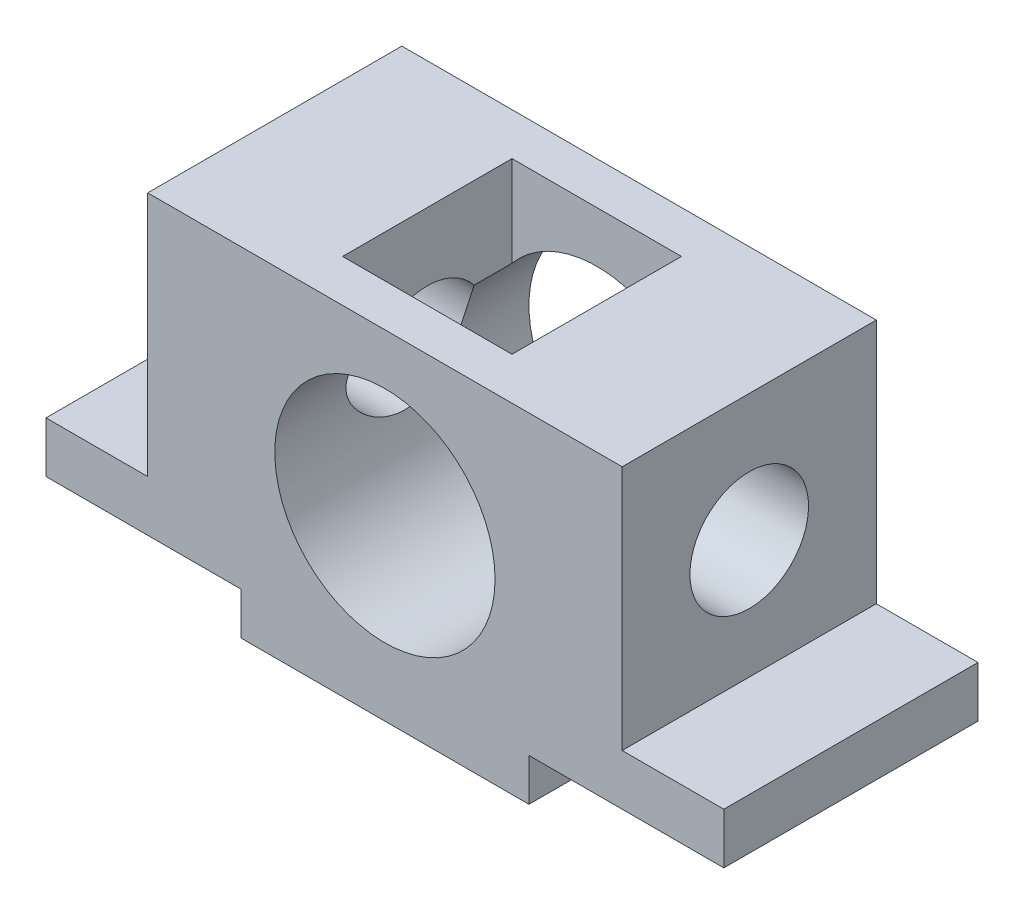
from build123d import *

# Parameters (mm, degrees)
EXTRUDE_1_DEPTH     = 30
SKETCH_2_R          = 13
CUT_EXTRUDE_1_DEPTH = 54.851648071
SKETCH_3_R          = 7
CUT_EXTRUDE_2_DEPTH = 77.96752562
CUT_EXTRUDE_3_REACH = 66.031
SKETCH_4_W          = 20
SKETCH_4_H          = 20


with BuildPart() as part:
    # Эскиз1 → Бобышка-Вытянуть1 (new body)
    with BuildSketch(Plane.XY):
        Polygon((-40, -15), (-17, -15), (-17, -20), (17, -20), (17, -15), (40, -15), (40, -9), (28, -9), (28, 20), (-28, 20), (-28, -9), (-40, -9), align=None)
    extrude(amount=EXTRUDE_1_DEPTH)

    # Эскиз2 → Вырез-Вытянуть1 (cut, through all)
    with BuildSketch(Plane.XY.offset(30)):
        with Locations((0, 1)):
            Circle(SKETCH_2_R)
    extrude(amount=-CUT_EXTRUDE_1_DEPTH, mode=Mode.SUBTRACT)

    # Эскиз3 → Вырез-Вытянуть2 (cut, through all)
    with BuildSketch(Plane.ZY.offset(28)):
        with Locations((15, 5)):
            Circle(SKETCH_3_R)
    extrude(amount=-CUT_EXTRUDE_2_DEPTH, mode=Mode.SUBTRACT)

    # Эскиз4 → Вырез-Вытянуть3 (cut, up to next)
    with BuildSketch(Plane(origin=(0, 20, 0), x_dir=(1, 0, 0), z_dir=(0, 1, 0)), mode=Mode.PRIVATE) as cut_extrude_3_sk1:
        with Locations((0, -15)):
            Rectangle(SKETCH_4_W, SKETCH_4_H)
    cut_extrude_3_tool1 = extrude(cut_extrude_3_sk1.sketch, amount=-CUT_EXTRUDE_3_REACH, mode=Mode.PRIVATE) & part.part
    add(cut_extrude_3_tool1.solids().sort_by_distance((0, 20, 15))[0], mode=Mode.SUBTRACT)


solid = part.part
